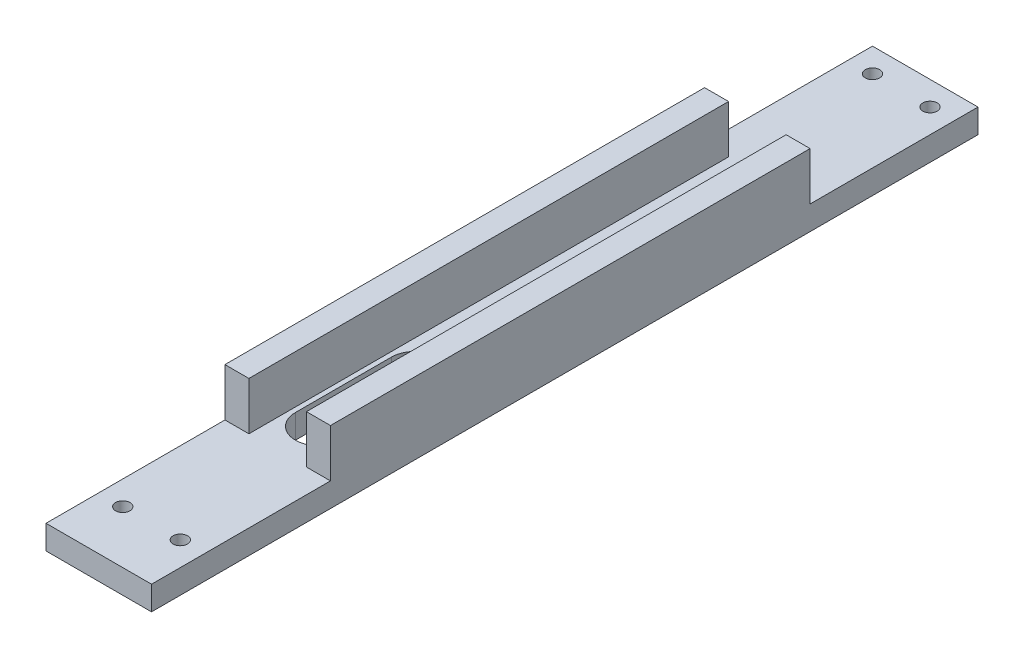
from build123d import *

# Parameters (mm, degrees)
SKETCH1_W           = 22
SKETCH1_H           = 166.3
SKETCH1_R           = 1.5
BOSS_EXTRUDE1_DEPTH = 5
CUT_EXTRUDE1_DEPTH  = 5
SKETCH3_W           = 22
SKETCH3_H           = 5
BOSS_EXTRUDE2_DEPTH = 6
SKETCH4_W           = 5
SKETCH4_H           = 100
BOSS_EXTRUDE3_DEPTH = 10


with BuildPart() as part:
    # Sketch1 → Boss-Extrude1 (new body)
    with BuildSketch(Plane(origin=(0, 0, 0), x_dir=(1, 0, 0), z_dir=(0, 1, 0))):
        with Locations((11, 83.15)):
            Rectangle(SKETCH1_W, SKETCH1_H)
        with Locations(Location((5, 161.3, 0), (0, 0, 270))):
            Circle(SKETCH1_R, mode=Mode.SUBTRACT)
        with Locations(Location((17, 161.3, 0), (0, 0, 270))):
            Circle(SKETCH1_R, mode=Mode.SUBTRACT)
        with Locations(Location((17, 5, 0), (0, 0, 270))):
            Circle(SKETCH1_R, mode=Mode.SUBTRACT)
        with Locations(Location((5, 5, 0), (0, 0, 270))):
            Circle(SKETCH1_R, mode=Mode.SUBTRACT)
    extrude(amount=BOSS_EXTRUDE1_DEPTH)

    # Sketch2 → Cut-Extrude1 (cut)
    with BuildSketch(Plane(origin=(0, 0, 0), x_dir=(-1, 0, 0), z_dir=(0, -1, 0))):
        with BuildLine():
            Line((-16, 40), (-16, 60))
            ThreePointArc((-16, 60), (-11, 65), (-6, 60))
            Line((-6, 60), (-6, 40))
            ThreePointArc((-6, 40), (-11, 35), (-16, 40))
        make_face()
    extrude(amount=-CUT_EXTRUDE1_DEPTH, mode=Mode.SUBTRACT)

    # Sketch3 → Boss-Extrude2 (add)
    with BuildSketch(Plane.XY):
        with Locations((11, 2.5)):
            Rectangle(SKETCH3_W, SKETCH3_H)
    extrude(amount=BOSS_EXTRUDE2_DEPTH)

    # Sketch4 → Boss-Extrude3 (add)
    with BuildSketch(Plane(origin=(0, 5, 0), x_dir=(1, 0, 0), z_dir=(0, 1, 0))):
        with Locations((2.5, 81.3)):
            Rectangle(SKETCH4_W, SKETCH4_H)
        with Locations((19.5, 81.3)):
            Rectangle(SKETCH4_W, SKETCH4_H)
    extrude(amount=BOSS_EXTRUDE3_DEPTH)


solid = part.part
